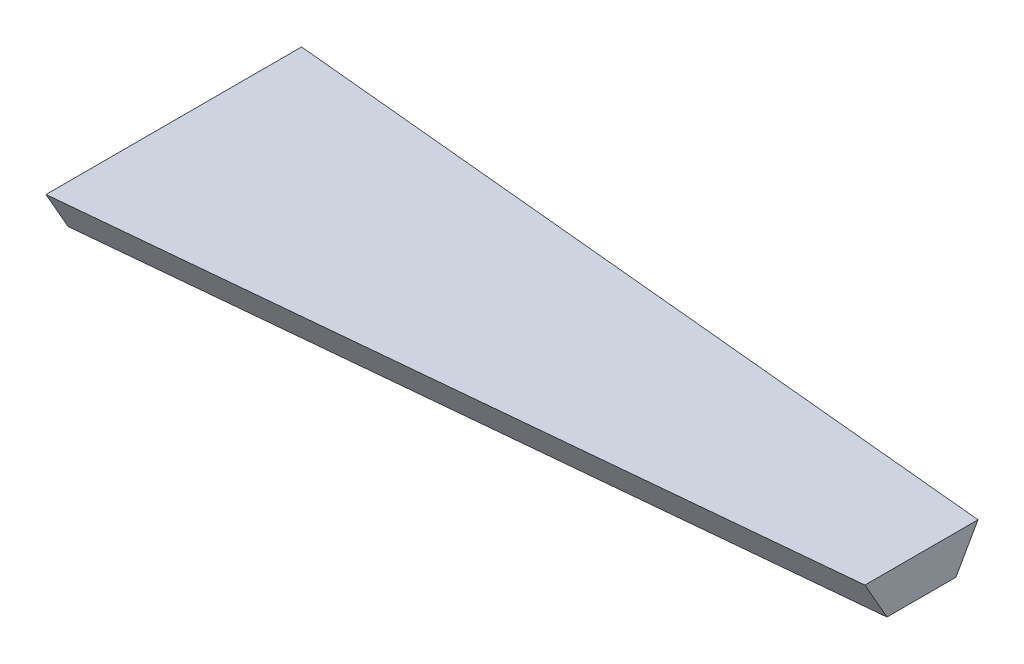
from build123d import *

# Parameters (mm, degrees)
BOSS_EXTRUDE1_DEPTH     = 19.05
BOSS_EXTRUDE1_DRAFT     = -29.54735891
CUT_EXTRUDE1_DEPTH      = 396.815250474
CUT_EXTRUDE1_DEPTH_BACK = 396.815250474
SKETCH2_OUTSIDE_W       = 472.779
SKETCH2_OUTSIDE_H       = 102.986
SKETCH2_OUTSIDE_W_2     = 367.245577586
SKETCH2_OUTSIDE_H_2     = 100.341978652


with BuildPart() as part:
    # Sketch1 → Boss-Extrude1 (with draft: the straight prism first)
    with BuildSketch(Plane(origin=(0, 0, 0), x_dir=(1, 0, 0), z_dir=(0, 1, 0))):
        Polygon((0, 0), (0, -103.835367594), (367.245577586, -68.840433797), (367.245577586, -34.994933797), align=None)
    extrude(amount=BOSS_EXTRUDE1_DEPTH)
    # Boss-Extrude1: the draft: its side faces are tilted about the plane it starts from
    boss_extrude1_sides = [part.faces().sort_by_distance(p)[0] for p in [
        (0, 9.525, 51.917683797),
        (183.622788793, 9.525, 86.337900695),
        (367.245577586, 9.525, 51.917683797),
        (183.622788793, 9.525, 17.497466898),
    ]]
    draft(boss_extrude1_sides, Plane(origin=(0, 0, 0), x_dir=(1, 0, 0), z_dir=(0, 1, 0)), BOSS_EXTRUDE1_DRAFT)

    # Sketch2 outside → Cut-Extrude1 (cut, two sides: drawn at the far end of the back side and taken through both)
    with BuildSketch(Plane.XY.offset(-CUT_EXTRUDE1_DEPTH_BACK)):
        with Locations((183.6225, 9.525)):
            Rectangle(SKETCH2_OUTSIDE_W, SKETCH2_OUTSIDE_H)
        with Locations((183.622788793, 50.170989326)):
            Rectangle(SKETCH2_OUTSIDE_W_2, SKETCH2_OUTSIDE_H_2, mode=Mode.SUBTRACT)
    extrude(amount=CUT_EXTRUDE1_DEPTH + CUT_EXTRUDE1_DEPTH_BACK, mode=Mode.SUBTRACT)


solid = part.part
